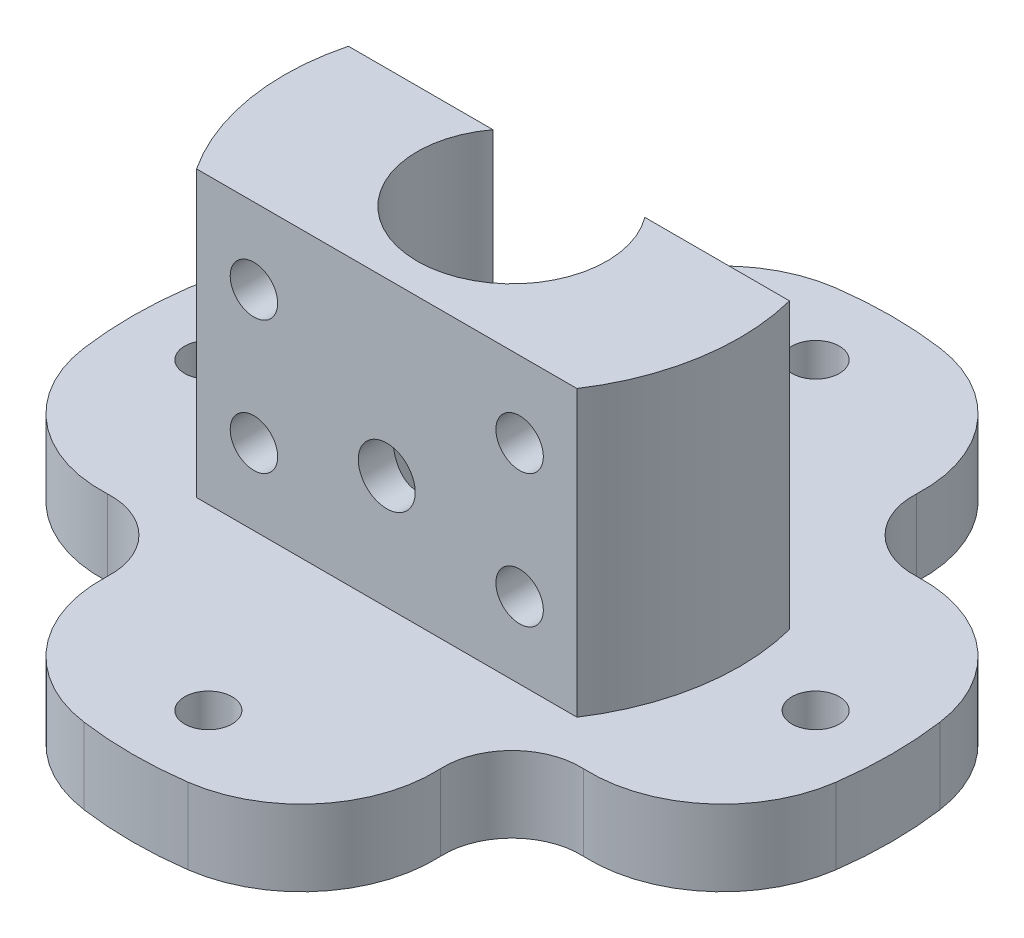
from build123d import *
from build123d.topology import SkipClean

# Parameters (mm, degrees)
EXTRUDE_1_DEPTH     = 15
EXTRUDE_START       = -4
SKETCH_3_R          = 20
SKETCH_3_R_2        = 1.25
SKETCH_3_R_3        = 5
EXTRUDE_2_DEPTH     = 4
SKETCH_4_R          = 3.6
CUT_EXTRUDE_1_DEPTH = 33.015621
FILLET_1_R          = 7
SKETCH_5_R          = 1.25
SKETCH_5_R_2        = 1.5
CUT_EXTRUDE_2_DEPTH = 34.970576


with BuildPart() as part:
    # 草图2 → 凸台-拉伸1 (new body)
    with BuildSketch(Plane(origin=(0, 0, 0), x_dir=(1, 0, 0), z_dir=(0, 1, 0))):
        with BuildLine():
            Line((-10.021976, -6.6), (10.021976, -6.6))
            ThreePointArc((10.021976, -6.6), (11.837332, -1.969158), (11.61895, 3))
            Line((11.61895, 3), (4, 3))
            ThreePointArc((4, 3), (0, -5), (-4, 3))
            Line((-4, 3), (-11.61895, 3))
            ThreePointArc((-11.61895, 3), (-11.837332, -1.969158), (-10.021976, -6.6))
        make_face()
    extrude(amount=EXTRUDE_1_DEPTH)

    # 草图3 → 凸台-拉伸2 (add)
    with SkipClean():  # the faces are left unmerged after this step: merging them gives an invalid solid
        with BuildSketch(Plane(origin=(0, 0, 0), x_dir=(1, 0, 0), z_dir=(0, 1, 0)).offset(EXTRUDE_START)):
            with Locations(Location((0, 0, 0), (0, 0, 270))):
                Circle(SKETCH_3_R)
            with Locations(Location((0, -16, 0), (0, 0, 270))):
                Circle(SKETCH_3_R_2, mode=Mode.SUBTRACT)
            with Locations(Location((16, 0, 0), (0, 0, 270))):
                Circle(SKETCH_3_R_2, mode=Mode.SUBTRACT)
            with Locations(Location((-16, 0, 0), (0, 0, 270))):
                Circle(SKETCH_3_R_2, mode=Mode.SUBTRACT)
            with Locations(Location((0, 16, 0), (0, 0, 270))):
                Circle(SKETCH_3_R_2, mode=Mode.SUBTRACT)
            with Locations(Location((0, 0, 0), (0, 0, 143.130102))):
                Circle(SKETCH_3_R_3, mode=Mode.SUBTRACT)
        extrude(amount=EXTRUDE_2_DEPTH)

    # 草图4 → 切除-拉伸1 (cut, through all)
    with SkipClean():  # the faces are left unmerged after this step: merging them gives an invalid solid
        with BuildSketch(Plane(origin=(0, 0, 0), x_dir=(1, 0, 0), z_dir=(0, 1, 0))):
            with Locations((12.374369, -12.374369)):
                Circle(SKETCH_4_R)
            with Locations((12.374369, 12.374369)):
                Circle(SKETCH_4_R)
            with Locations((-12.374369, 12.374369)):
                Circle(SKETCH_4_R)
            with Locations((-12.374369, -12.374369)):
                Circle(SKETCH_4_R)
        extrude(amount=-CUT_EXTRUDE_1_DEPTH, mode=Mode.SUBTRACT)

    # 圆角1
    fillet_1_edges = [part.edges().sort_by_distance(p)[0] for p in [
        (-12.053138, -2, 15.960008),
        (-15.960008, -2, 12.053138),
        (-15.960008, -2, -12.053138),
        (-12.053138, -2, -15.960008),
        (12.053138, -2, -15.960008),
        (15.960008, -2, -12.053138),
        (15.960008, -2, 12.053138),
        (12.053138, -2, 15.960008),
    ]]
    fillet(fillet_1_edges, radius=FILLET_1_R)

    # 草图5 → 切除-拉伸2 (cut, through all)
    with SkipClean():  # the faces are left unmerged after this step: merging them gives an invalid solid
        with BuildSketch(Plane(origin=(0, 0, -3), x_dir=(-1, 0, 0), z_dir=(0, 0, -1))):
            with Locations((-7, 11)):
                Circle(SKETCH_5_R)
            with Locations((-7, 4)):
                Circle(SKETCH_5_R)
            with Locations((7, 11)):
                Circle(SKETCH_5_R)
            with Locations((7, 4)):
                Circle(SKETCH_5_R)
            with Locations((0, 6)):
                Circle(SKETCH_5_R_2)
        extrude(amount=-CUT_EXTRUDE_2_DEPTH, mode=Mode.SUBTRACT)


solid = part.part
